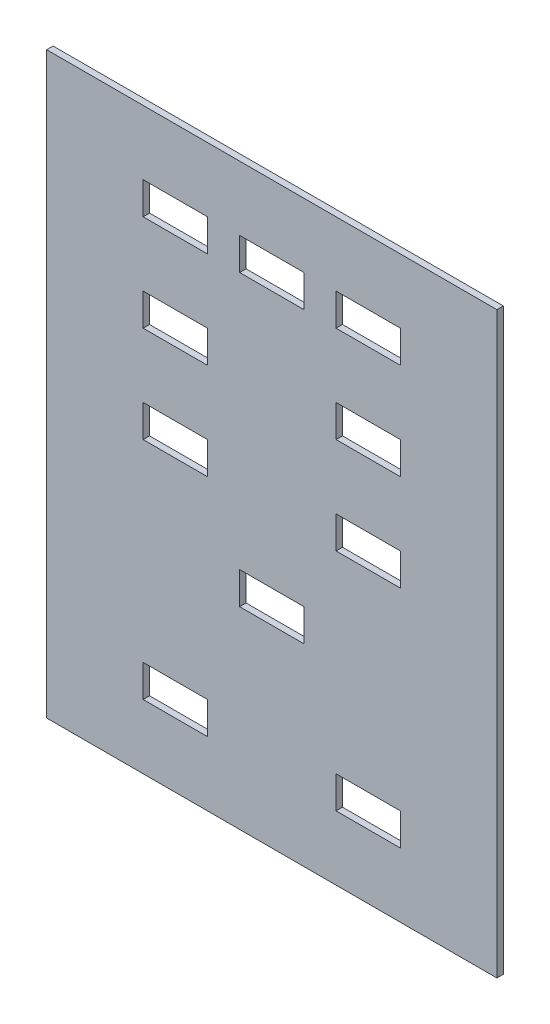
from build123d import *

# Parameters (mm, degrees)
SKETCH1_W           = 350
SKETCH1_H           = 450
BOSS_EXTRUDE1_DEPTH = 5
SKETCH2_W           = 50
SKETCH2_H           = 25
CUT_EXTRUDE1_DEPTH  = 571.109638578


with BuildPart() as part:
    # Sketch1 → Boss-Extrude1 (new body)
    with BuildSketch(Plane.XY):
        with Locations((175, 225)):
            Rectangle(SKETCH1_W, SKETCH1_H)
    extrude(amount=BOSS_EXTRUDE1_DEPTH)

    # Sketch2 → Cut-Extrude1 (cut, through all)
    with BuildSketch(Plane.XY.offset(5)):
        with Locations((100, 387.5)):
            Rectangle(SKETCH2_W, SKETCH2_H)
    cut_extrude1 = extrude(amount=-CUT_EXTRUDE1_DEPTH, mode=Mode.SUBTRACT)

    # Sketch-Pattern1: Cut-Extrude1 at 9 more places
    with Locations((75, 0, 0), (150, 0, 0), (0, -75, 0), (0, -150, 0), (0, -325, 0), (150, -75, 0), (150, -150, 0), (75, -225, 0), (150, -325, 0)):
        add(cut_extrude1, mode=Mode.SUBTRACT)


solid = part.part
